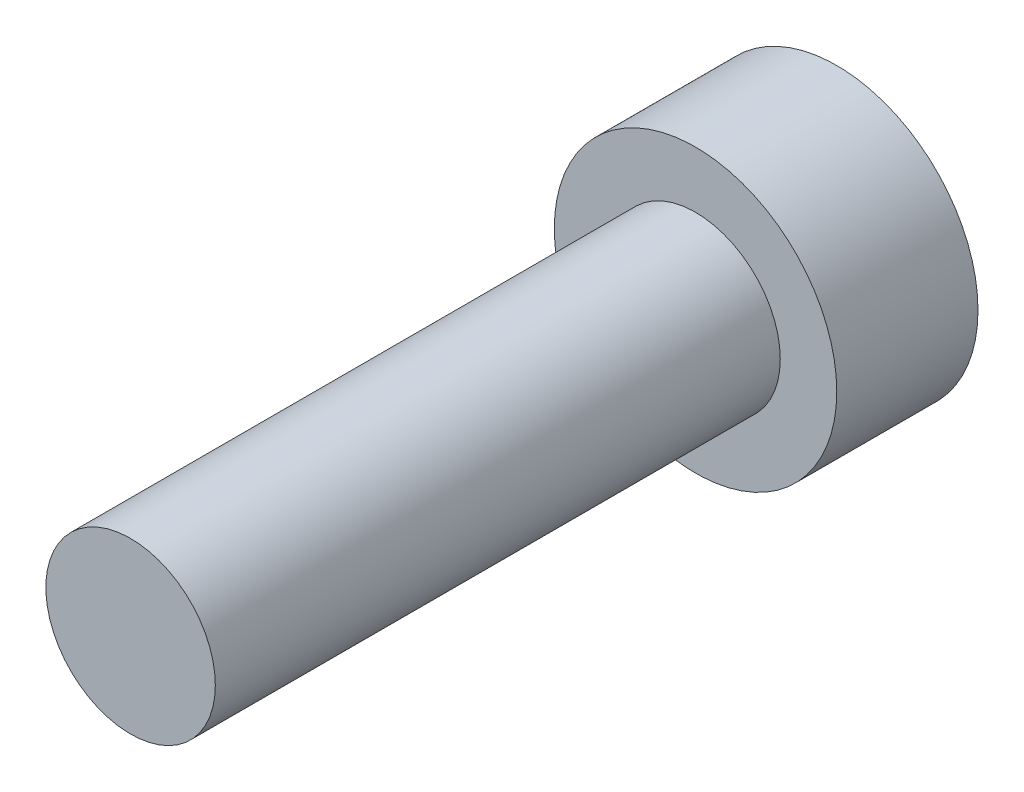
from build123d import *

# Parameters (mm, degrees)
SKETCH1_R           = 2.5
BOSS_EXTRUDE3_DEPTH = 2.5
SKETCH1_3_R         = 1.5
BOSS_EXTRUDE4_DEPTH = 10


with BuildPart() as part:
    # Sketch1 → Boss-Extrude3 (new body)
    with BuildSketch(Plane.XY):
        Circle(SKETCH1_R)
    extrude(amount=-BOSS_EXTRUDE3_DEPTH)

    # Sketch1<3> → Boss-Extrude4 (add)
    with BuildSketch(Plane.XY):
        Circle(SKETCH1_3_R)
    extrude(amount=BOSS_EXTRUDE4_DEPTH)


solid = part.part
